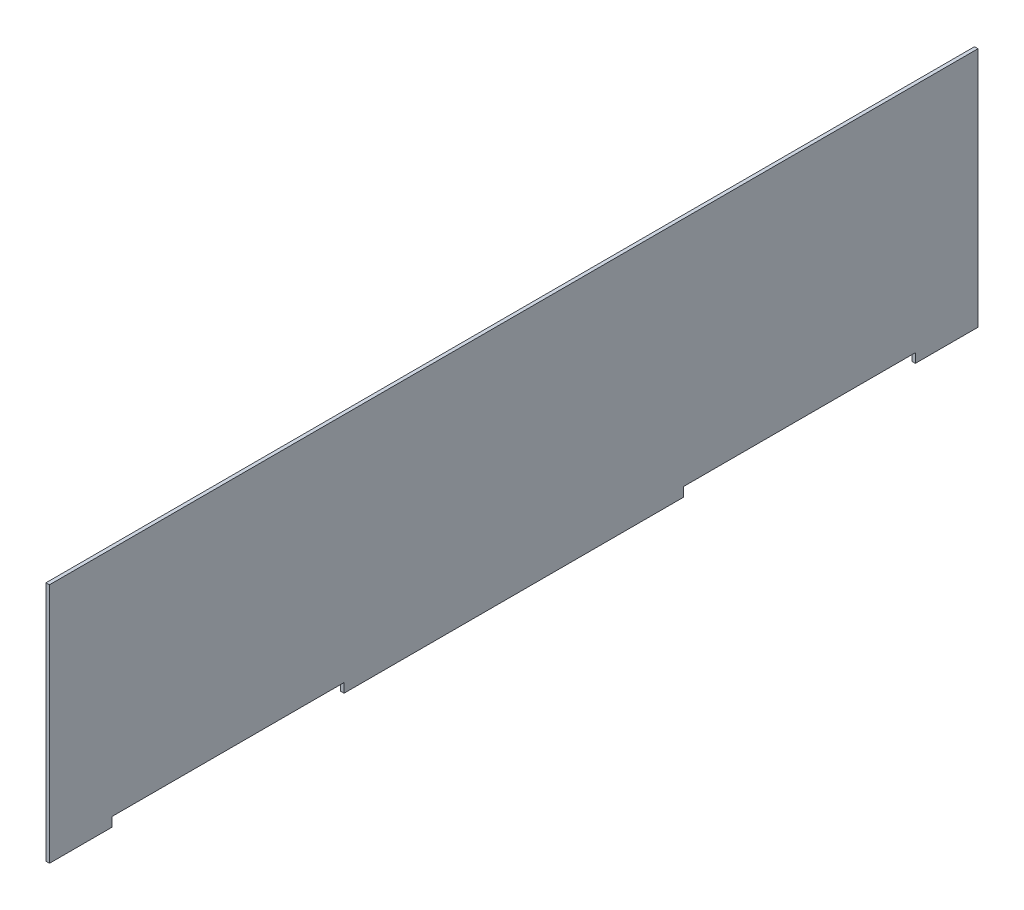
from build123d import *

# Parameters (mm, degrees)
BOSS_EXTRUDE1_DEPTH = 30


with BuildPart() as part:
    # Sketch1 → Boss-Extrude1 (new body)
    with BuildSketch(Plane(origin=(0, 0, 0), x_dir=(0, 0, -1), z_dir=(1, 0, 0))):
        Polygon((-4991.985328694, -1296.943477852), (-4451.985328694, -1296.943477852), (-4451.985328694, -1216.943477852), (-2451.985328694, -1216.943477852), (-2451.985328694, -1296.943477852), (474.014671306, -1296.943477852), (474.014671306, -1216.943477852), (2474.014671306, -1216.943477852), (2474.014671306, -1296.943477852), (3014.014671306, -1296.943477852), (3014.014671306, 783.056522148), (-4991.985328694, 783.056522148), align=None)
    extrude(amount=BOSS_EXTRUDE1_DEPTH)


solid = part.part
